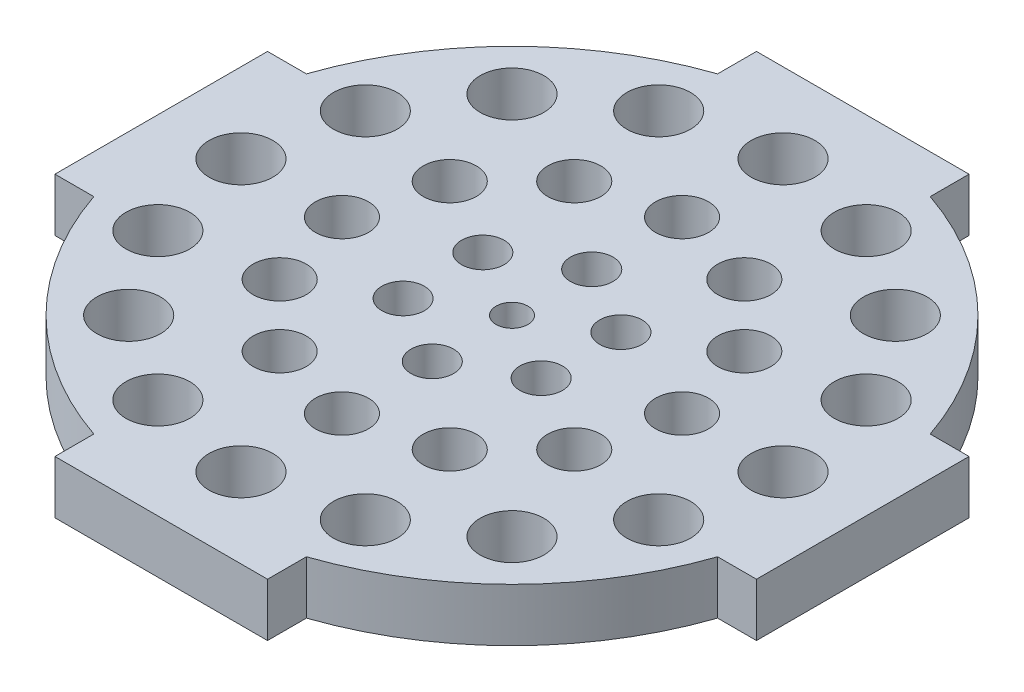
from build123d import *

# Parameters (mm, degrees)
SKETCH1_W           = 10
SKETCH1_H           = 10
BOSS_EXTRUDE1_DEPTH = 2.5
SKETCH2_R           = 0.75
SKETCH2_R_2         = 1
SKETCH2_R_3         = 1.25
SKETCH2_R_4         = 1.5
CUT_EXTRUDE1_DEPTH  = 24.468063405


with BuildPart() as part:
    # Sketch1 → Boss-Extrude1 (new body)
    with BuildSketch(Plane(origin=(0, 0, 0), x_dir=(1, 0, 0), z_dir=(0, 1, 0))):
        Rectangle(SKETCH1_W, SKETCH1_H)
        with BuildLine():
            Line((-5, -5), (-5, 5))
            Line((-5, 5), (-14.671400751, 5))
            ThreePointArc((-14.671400751, 5), (-15.5, 0), (-14.671400751, -5))
            Line((-14.671400751, -5), (-5, -5))
        make_face()
        with BuildLine():
            Line((-14.671400751, 5), (-5, 5))
            Line((-5, 5), (-5, 14.671400751))
            ThreePointArc((-5, 14.671400751), (-10.960155108, 10.960155108), (-14.671400751, 5))
        make_face()
        with BuildLine():
            Line((-5, 5), (5, 5))
            Line((5, 5), (5, 14.671400751))
            ThreePointArc((5, 14.671400751), (0, 15.5), (-5, 14.671400751))
            Line((-5, 14.671400751), (-5, 5))
        make_face()
        with BuildLine():
            Line((5, 5), (14.671400751, 5))
            ThreePointArc((14.671400751, 5), (10.960155108, 10.960155108), (5, 14.671400751))
            Line((5, 14.671400751), (5, 5))
        make_face()
        with BuildLine():
            ThreePointArc((15.5, 0), (15.291447146, 2.534096324), (14.671400751, 5))
            Line((14.671400751, 5), (5, 5))
            Line((5, 5), (5, -5))
            Line((5, -5), (14.671400751, -5))
            ThreePointArc((14.671400751, -5), (15.291447146, -2.534096324), (15.5, 0))
        make_face()
        with BuildLine():
            Line((16.5, -5), (16.5, 5))
            Line((16.5, 5), (14.671400751, 5))
            ThreePointArc((14.671400751, 5), (15.291447146, 2.534096324), (15.5, 0))
            ThreePointArc((15.5, 0), (15.291447146, -2.534096324), (14.671400751, -5))
            Line((14.671400751, -5), (16.5, -5))
        make_face()
        with BuildLine():
            ThreePointArc((5, -14.671400751), (10.960155108, -10.960155108), (14.671400751, -5))
            Line((14.671400751, -5), (5, -5))
            Line((5, -5), (5, -14.671400751))
        make_face()
        with BuildLine():
            Line((5, -14.671400751), (5, -5))
            Line((5, -5), (-5, -5))
            Line((-5, -5), (-5, -14.671400751))
            ThreePointArc((-5, -14.671400751), (0, -15.5), (5, -14.671400751))
        make_face()
        with BuildLine():
            Line((-5, -14.671400751), (-5, -5))
            Line((-5, -5), (-14.671400751, -5))
            ThreePointArc((-14.671400751, -5), (-10.960155108, -10.960155108), (-5, -14.671400751))
        make_face()
        with BuildLine():
            ThreePointArc((-14.671400751, -5), (-15.5, 0), (-14.671400751, 5))
            Line((-14.671400751, 5), (-16.5, 5))
            Line((-16.5, 5), (-16.5, -5))
            Line((-16.5, -5), (-14.671400751, -5))
        make_face()
        with BuildLine():
            Line((5, -16.5), (5, -14.671400751))
            ThreePointArc((5, -14.671400751), (0, -15.5), (-5, -14.671400751))
            Line((-5, -14.671400751), (-5, -16.5))
            Line((-5, -16.5), (5, -16.5))
        make_face()
        with BuildLine():
            ThreePointArc((-5, 14.671400751), (0, 15.5), (5, 14.671400751))
            Line((5, 14.671400751), (5, 16.5))
            Line((5, 16.5), (-5, 16.5))
            Line((-5, 16.5), (-5, 14.671400751))
        make_face()
    extrude(amount=BOSS_EXTRUDE1_DEPTH)

    # Sketch2 → Cut-Extrude1 (cut, through all)
    with BuildSketch(Plane(origin=(0, 2.5, 0), x_dir=(1, 0, 0), z_dir=(0, 1, 0))):
        with Locations(Location((0, 0, 0), (0, 0, 270))):
            Circle(SKETCH2_R)
        with Locations(Location((0, 3.75, 0), (0, 0, 270))):
            Circle(SKETCH2_R_2)
        with Locations(Location((0, 8, 0), (0, 0, 270))):
            Circle(SKETCH2_R_3)
        with Locations(Location((0, 12.75, 0), (0, 0, 270))):
            Circle(SKETCH2_R_4)
        with Locations(Location((3.247595264, 1.875, 0), (0, 0, 270))):
            Circle(SKETCH2_R_2)
        with Locations(Location((3.247595264, -1.875, 0), (0, 0, 270))):
            Circle(SKETCH2_R_2)
        with Locations(Location((0, -3.75, 0), (0, 0, 270))):
            Circle(SKETCH2_R_2)
        with Locations(Location((-3.247595264, -1.875, 0), (0, 0, 270))):
            Circle(SKETCH2_R_2)
        with Locations(Location((-3.247595264, 1.875, 0), (0, 0, 270))):
            Circle(SKETCH2_R_2)
        with Locations(Location((4, 6.92820323, 0), (0, 0, 270))):
            Circle(SKETCH2_R_3)
        with Locations(Location((6.92820323, 4, 0), (0, 0, 270))):
            Circle(SKETCH2_R_3)
        with Locations(Location((8, 0, 0), (0, 0, 270))):
            Circle(SKETCH2_R_3)
        with Locations(Location((6.92820323, -4, 0), (0, 0, 270))):
            Circle(SKETCH2_R_3)
        with Locations(Location((4, -6.92820323, 0), (0, 0, 270))):
            Circle(SKETCH2_R_3)
        with Locations(Location((0, -8, 0), (0, 0, 270))):
            Circle(SKETCH2_R_3)
        with Locations(Location((-4, -6.92820323, 0), (0, 0, 270))):
            Circle(SKETCH2_R_3)
        with Locations(Location((-6.92820323, -4, 0), (0, 0, 270))):
            Circle(SKETCH2_R_3)
        with Locations(Location((-8, 0, 0), (0, 0, 270))):
            Circle(SKETCH2_R_3)
        with Locations(Location((-6.92820323, 4, 0), (0, 0, 270))):
            Circle(SKETCH2_R_3)
        with Locations(Location((-4, 6.92820323, 0), (0, 0, 270))):
            Circle(SKETCH2_R_3)
        with Locations(Location((4.879213763, 11.77946404, 0), (0, 0, 270))):
            Circle(SKETCH2_R_4)
        with Locations(Location((9.01561146, 9.01561146, 0), (0, 0, 270))):
            Circle(SKETCH2_R_4)
        with Locations(Location((11.77946404, 4.879213763, 0), (0, 0, 270))):
            Circle(SKETCH2_R_4)
        with Locations(Location((12.75, 0, 0), (0, 0, 270))):
            Circle(SKETCH2_R_4)
        with Locations(Location((11.77946404, -4.879213763, 0), (0, 0, 270))):
            Circle(SKETCH2_R_4)
        with Locations(Location((9.01561146, -9.01561146, 0), (0, 0, 270))):
            Circle(SKETCH2_R_4)
        with Locations(Location((4.879213763, -11.77946404, 0), (0, 0, 270))):
            Circle(SKETCH2_R_4)
        with Locations(Location((0, -12.75, 0), (0, 0, 270))):
            Circle(SKETCH2_R_4)
        with Locations(Location((-4.879213763, -11.77946404, 0), (0, 0, 270))):
            Circle(SKETCH2_R_4)
        with Locations(Location((-9.01561146, -9.01561146, 0), (0, 0, 270))):
            Circle(SKETCH2_R_4)
        with Locations(Location((-11.77946404, -4.879213763, 0), (0, 0, 270))):
            Circle(SKETCH2_R_4)
        with Locations(Location((-12.75, 0, 0), (0, 0, 270))):
            Circle(SKETCH2_R_4)
        with Locations(Location((-11.77946404, 4.879213763, 0), (0, 0, 270))):
            Circle(SKETCH2_R_4)
        with Locations(Location((-9.01561146, 9.01561146, 0), (0, 0, 270))):
            Circle(SKETCH2_R_4)
        with Locations(Location((-4.879213763, 11.77946404, 0), (0, 0, 270))):
            Circle(SKETCH2_R_4)
    extrude(amount=-CUT_EXTRUDE1_DEPTH, mode=Mode.SUBTRACT)


solid = part.part
